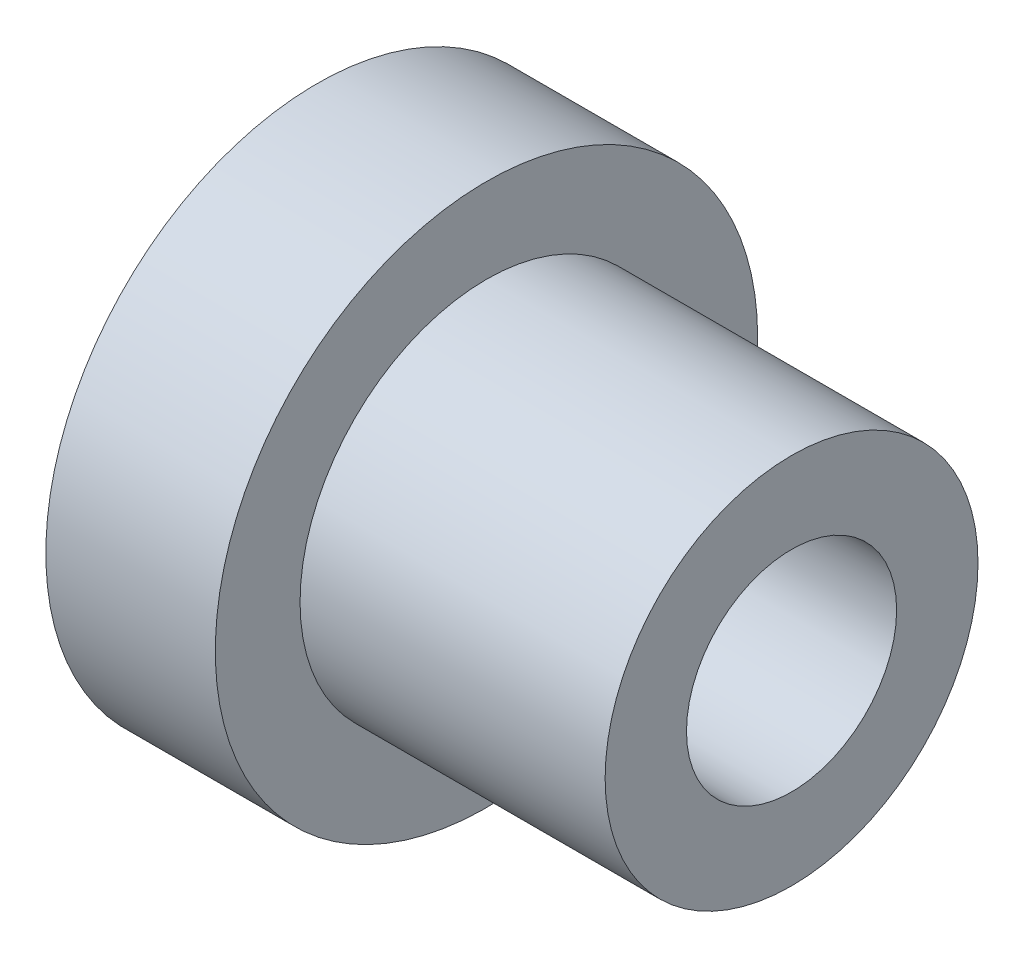
from build123d import *


with BuildPart() as part:
    # Sketch1 → Revolve1 (revolve)
    with BuildSketch(Plane.XY, mode=Mode.PRIVATE) as revolve1_sk:
        Polygon((-2.85, 5.5), (-2.85, 8), (-7.85, 8), (-7.85, 6), (-5.35, 6), (-5.35, 3.1), (6.15, 3.1), (6.15, 5.5), align=None)
    revolve(revolve1_sk.sketch.rotate(Axis((-7.85, 0, 0), (1, 0, 0)), 270), axis=Axis((-7.85, 0, 0), (1, 0, 0)))


solid = part.part
